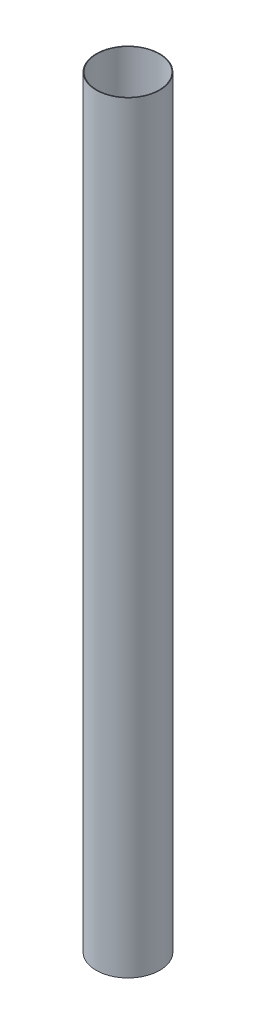
from build123d import *

# Parameters (mm, degrees)
SKETCH_1_R      = 50
SKETCH_1_R_2    = 49
EXTRUDE_1_DEPTH = 1200


with BuildPart() as part:
    # 草图1 → 凸台-拉伸1 (new body)
    with BuildSketch(Plane(origin=(0, 0, 0), x_dir=(1, 0, 0), z_dir=(0, 1, 0))):
        with Locations(Location((0, 0, 0), (0, 0, 270))):
            Circle(SKETCH_1_R)
        with Locations(Location((0, 0, 0), (0, 0, 270))):
            Circle(SKETCH_1_R_2, mode=Mode.SUBTRACT)
    extrude(amount=EXTRUDE_1_DEPTH)


solid = part.part
